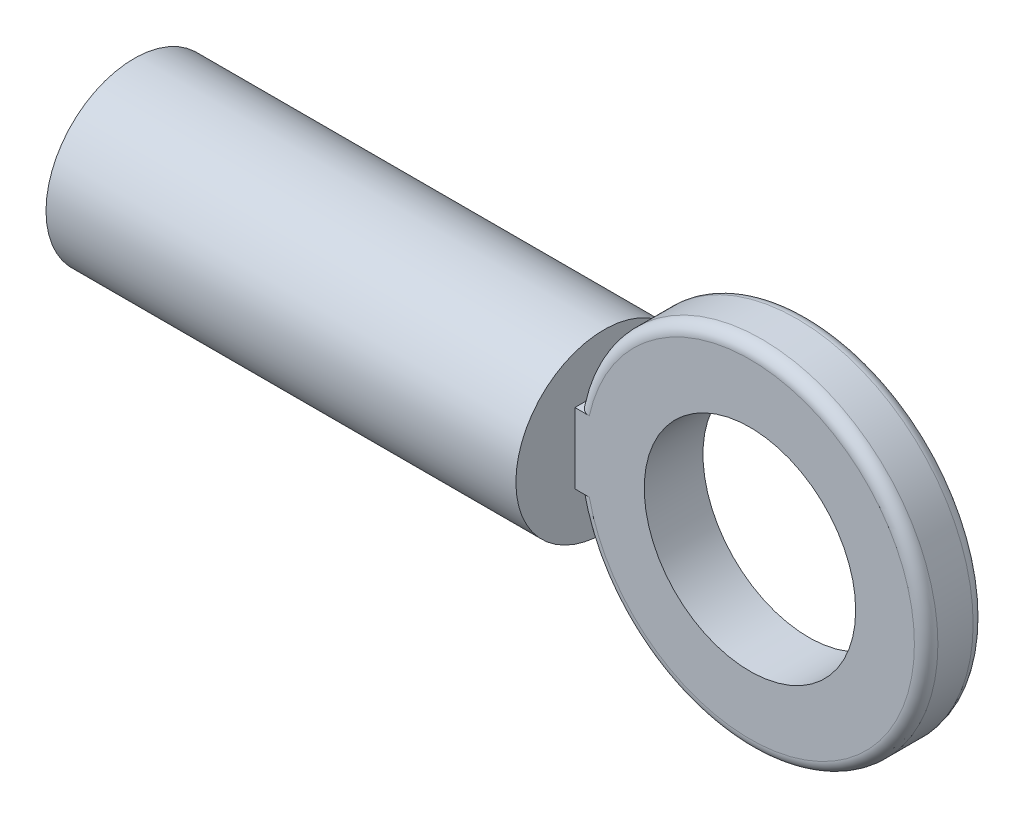
from build123d import *

# Parameters (mm, degrees)
BOSS_EXTRUDE2_DEPTH = 5
SKETCH6_R           = 9
CUT_EXTRUDE1_DEPTH  = 58.130534293
FILLET2_R           = 1
SKETCH7_R           = 7.5
BOSS_EXTRUDE3_DEPTH = 40


with BuildPart() as part:
    # Sketch4 → Boss-Extrude2 (new body)
    with BuildSketch(Plane.XY):
        with BuildLine():
            Line((-54.898979486, -3), (-54.898979486, 3))
            Line((-54.898979486, 3), (-14.696938457, 3))
            ThreePointArc((-14.696938457, 3), (15, 0), (-14.696938457, -3))
            Line((-14.696938457, -3), (-54.898979486, -3))
        make_face()
    extrude(amount=BOSS_EXTRUDE2_DEPTH)

    # Sketch6 → Cut-Extrude1 (cut, through all)
    with BuildSketch(Plane.XY.offset(5)):
        Circle(SKETCH6_R)
    extrude(amount=-CUT_EXTRUDE1_DEPTH, mode=Mode.SUBTRACT)

    # Fillet2
    fillet2_edges = [part.edges().sort_by_distance(p)[0] for p in [
        (15, 0, 5),
        (15, 0, 0),
    ]]
    fillet(fillet2_edges, radius=FILLET2_R)

    # Sketch7 → Boss-Extrude3 (add)
    with BuildSketch(Plane.ZY.offset(54.898979486)):
        with Locations((2.528088008, 0)):
            Circle(SKETCH7_R)
    extrude(amount=-BOSS_EXTRUDE3_DEPTH)


solid = part.part
